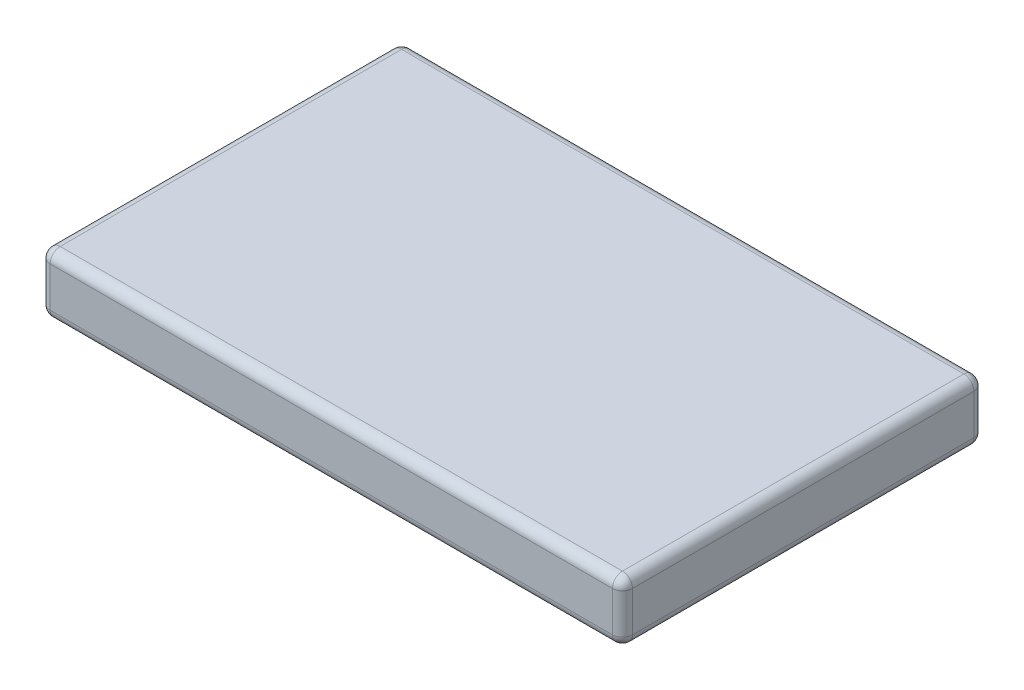
from build123d import *

# Parameters (mm, degrees)
ESBO_O1_W                = 58
ESBO_O1_H                = 36
RESSALTO_EXTRUS_O1_DEPTH = 6
FILETE1_R                = 1


with BuildPart() as part:
    # Esboço1 → Ressalto-extrusão1 (new body)
    with BuildSketch(Plane(origin=(0, 0, 0), x_dir=(1, 0, 0), z_dir=(0, 1, 0))):
        Rectangle(ESBO_O1_W, ESBO_O1_H)
    extrude(amount=RESSALTO_EXTRUS_O1_DEPTH)

    # Filete1
    filete1_edges = [part.edges().sort_by_distance(p)[0] for p in [
        (29, 6, 0),
        (0, 6, -18),
        (-29, 6, 0),
        (0, 0, -18),
        (29, 0, 0),
        (0, 0, 18),
        (-29, 0, 0),
        (-29, 3, -18),
        (29, 3, -18),
        (29, 3, 18),
        (-29, 3, 18),
        (0, 6, 18),
    ]]
    fillet(filete1_edges, radius=FILETE1_R)


solid = part.part
